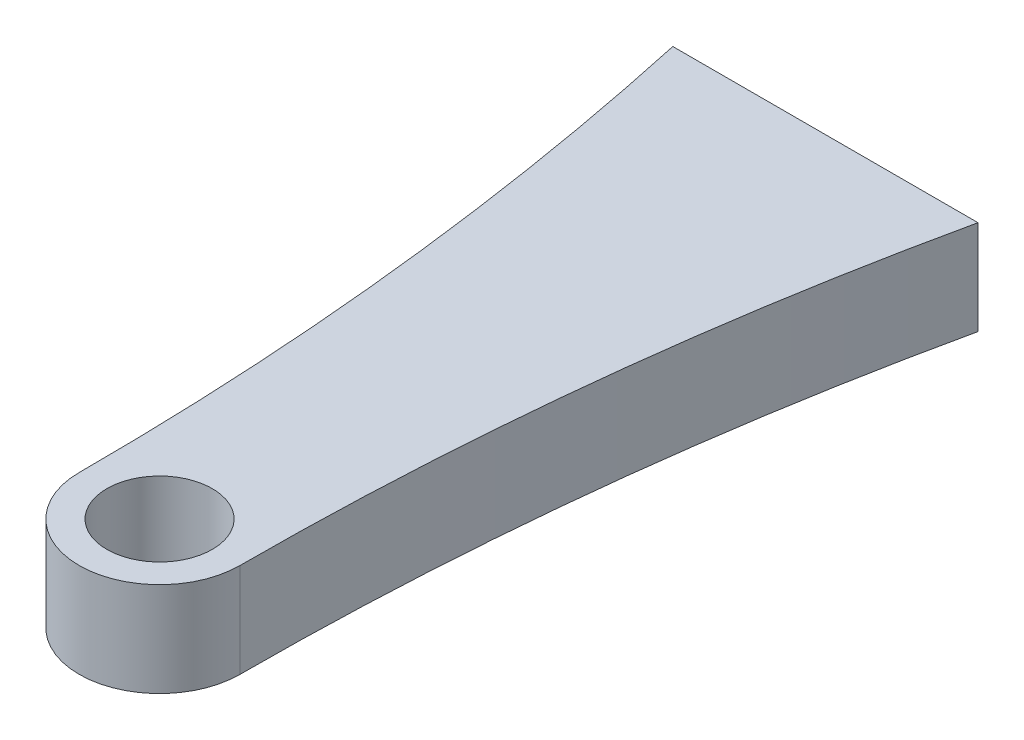
from build123d import *

# Parameters (mm, degrees)
SKETCH1_R           = 12.065
BOSS_EXTRUDE1_DEPTH = 10.795


with BuildPart() as part:
    # Sketch1 → Boss-Extrude1 (new, symmetric)
    with BuildSketch(Plane(origin=(0, 0, 0), x_dir=(1, 0, 0), z_dir=(0, 1, 0))):
        with BuildLine():
            Line((-34.925, 152.4), (34.925, 152.4))
            ThreePointArc((34.925, 152.4), (22.554539653, 76.645841538), (18.415, 0))
            ThreePointArc((18.415, 0), (0, -18.415), (-18.415, 0))
            ThreePointArc((-18.415, 0), (-22.554539653, 76.645841538), (-34.925, 152.4))
        make_face()
        with Locations(Location((0, 0, 0), (0, 0, 270))):
            Circle(SKETCH1_R, mode=Mode.SUBTRACT)
    extrude(amount=BOSS_EXTRUDE1_DEPTH, both=True)


solid = part.part
